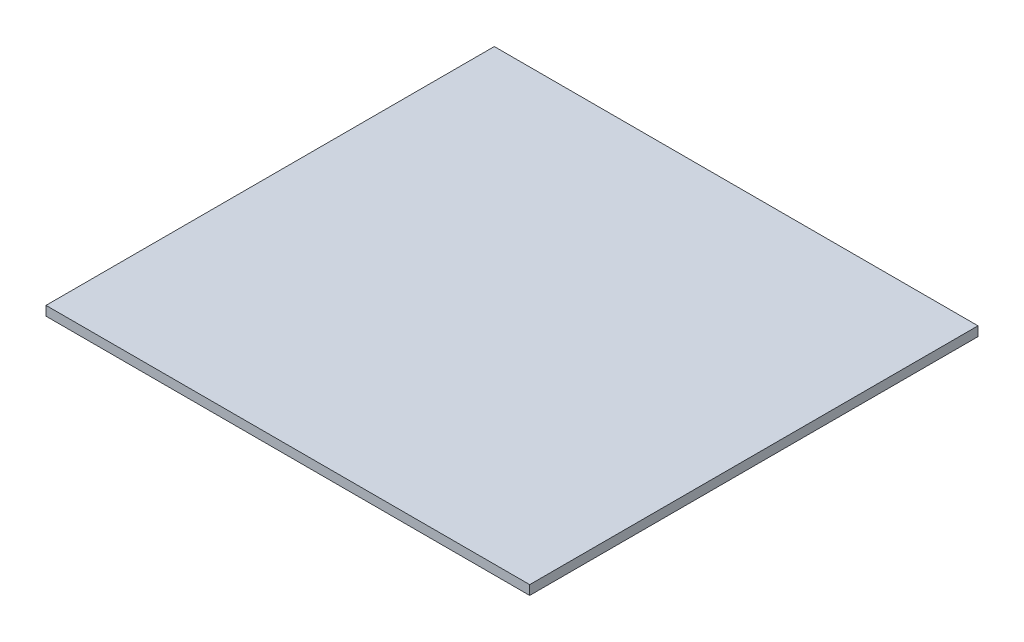
from build123d import *

# Parameters (mm, degrees)
SKETCH1_W           = 2082.8
SKETCH1_H           = 1930.4
BOSS_EXTRUDE1_DEPTH = 40.48125


with BuildPart() as part:
    # Sketch1 → Boss-Extrude1 (new body)
    with BuildSketch(Plane(origin=(0, 0, 0), x_dir=(1, 0, 0), z_dir=(0, 1, 0))):
        with Locations((-224.675895885, 0.122022136)):
            Rectangle(SKETCH1_W, SKETCH1_H)
    extrude(amount=BOSS_EXTRUDE1_DEPTH)


solid = part.part
